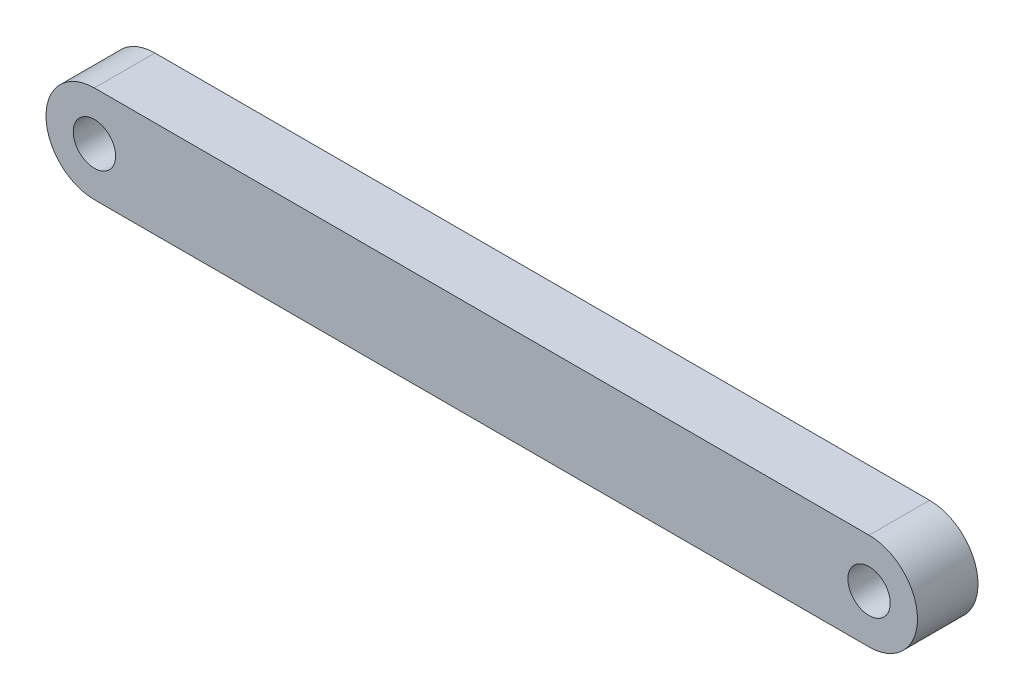
from build123d import *

# Parameters (mm, degrees)
SKETCH1_R           = 1.75
BOSS_EXTRUDE1_DEPTH = 5


with BuildPart() as part:
    # Sketch1 → Boss-Extrude1 (new body)
    with BuildSketch(Plane(origin=(0, 0, 0), x_dir=(0, 1, 0), z_dir=(0, 0, 1))):
        with BuildLine():
            Line((-4, 0), (-4, 64))
            ThreePointArc((-4, 64), (0, 68), (4, 64))
            Line((4, 64), (4, 0))
            ThreePointArc((4, 0), (0, -4), (-4, 0))
        make_face()
        with Locations(Location((0, 64, 0), (0, 0, 270))):
            Circle(SKETCH1_R, mode=Mode.SUBTRACT)
        with Locations(Location((0, 0, 0), (0, 0, 270))):
            Circle(SKETCH1_R, mode=Mode.SUBTRACT)
    extrude(amount=BOSS_EXTRUDE1_DEPTH)


solid = part.part
